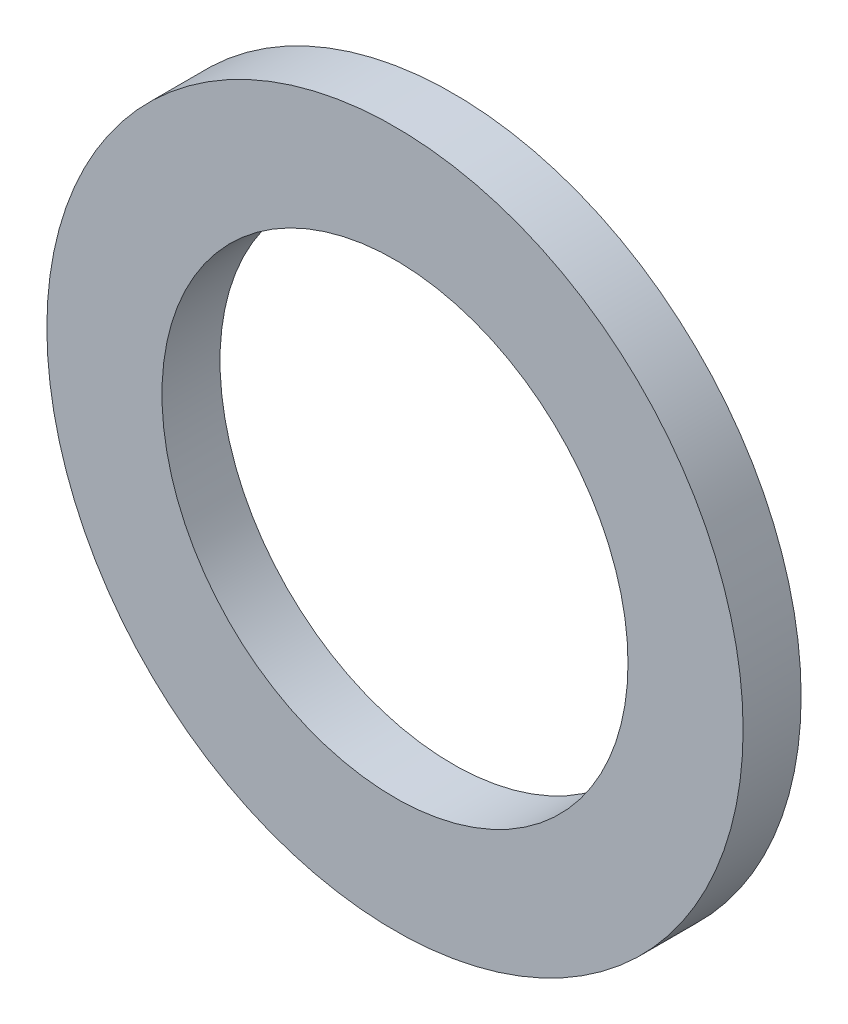
from build123d import *

# Parameters (mm, degrees)
SKETCH1_R      = 9.525
SKETCH1_R_2    = 6.3754
EXTRUDE1_DEPTH = 0.79375


with BuildPart() as part:
    # Sketch1 → Extrude1 (new, symmetric)
    with BuildSketch(Plane.XY):
        Circle(SKETCH1_R)
        Circle(SKETCH1_R_2, mode=Mode.SUBTRACT)
    extrude(amount=EXTRUDE1_DEPTH, both=True)


solid = part.part
